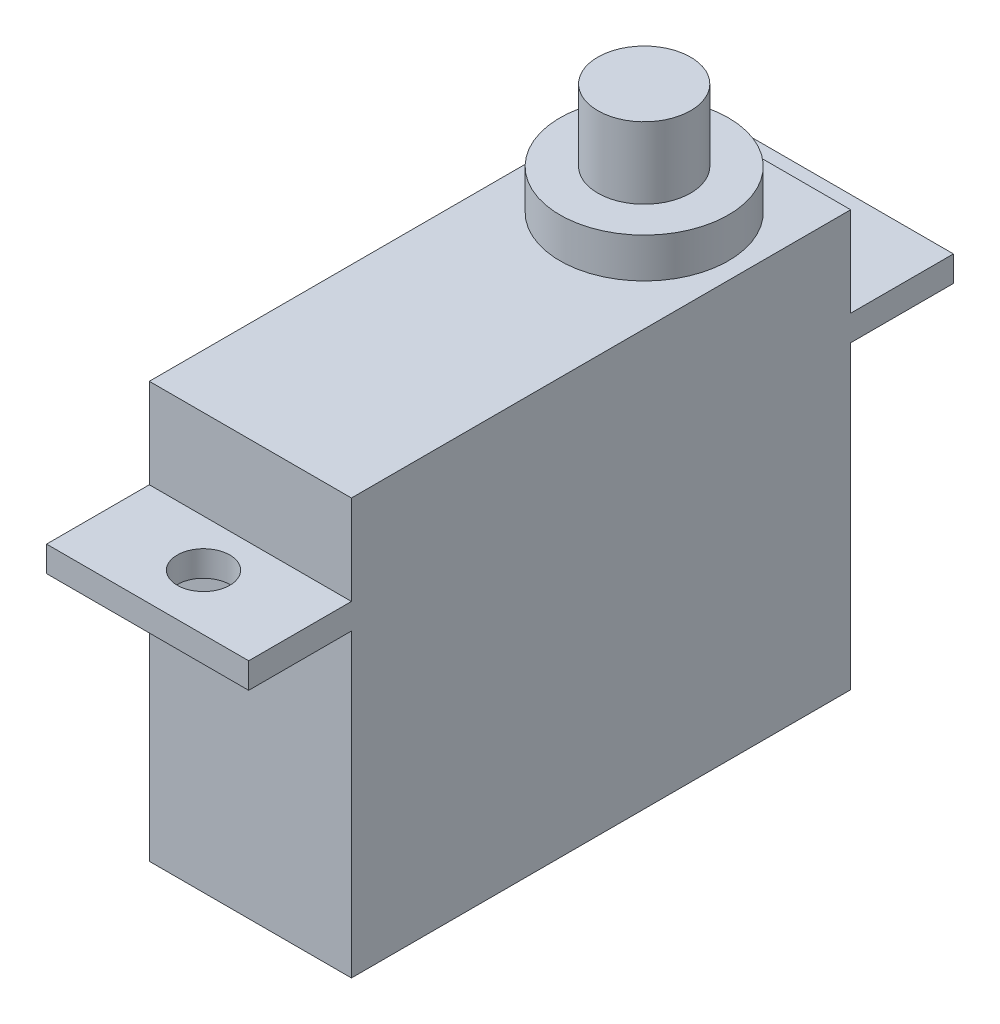
from build123d import *

# Parameters (mm, degrees)
SKETCH1_W           = 7.62
SKETCH1_H           = 18.8214
BOSS_EXTRUDE1_DEPTH = 15.6718
SKETCH2_R           = 0.9906
BOSS_EXTRUDE2_DEPTH = 0.9652
SKETCH3_R           = 3.175
BOSS_EXTRUDE3_DEPTH = 1.4986
SKETCH4_R           = 1.75
BOSS_EXTRUDE4_DEPTH = 2.6924


with BuildPart() as part:
    # Sketch1 → Boss-Extrude1 (new body)
    with BuildSketch(Plane(origin=(0, 0, 0), x_dir=(1, 0, 0), z_dir=(0, 1, 0))):
        with Locations((3.81, 9.4107)):
            Rectangle(SKETCH1_W, SKETCH1_H)
    extrude(amount=BOSS_EXTRUDE1_DEPTH)

    # Sketch2 → Boss-Extrude2 (add)
    # profile 1 of 2: a face of its own
    with BuildSketch(Plane(origin=(0, 11.3284, 0), x_dir=(-1, 0, 0), z_dir=(0, -1, 0))):
        Polygon((0, 0), (-7.62, 0), (-7.62, -3.8735), (-5.08, -3.8735), (-2.54, -3.8735), (0, -3.8735), align=None)
        with Locations(Location((-3.81, -1.7653, 0), (0, 0, 90))):
            Circle(SKETCH2_R, mode=Mode.SUBTRACT)
    # profile 2 of 2: a face of its own
    with BuildSketch(Plane(origin=(0, 11.3284, 0), x_dir=(-1, 0, 0), z_dir=(0, -1, 0))):
        Polygon((-7.62, 18.8214), (0, 18.8214), (0, 22.6949), (-2.54, 22.6949), (-5.08, 22.6949), (-7.62, 22.6949), align=None)
        with Locations(Location((-3.81, 20.5867, 0), (0, 0, 90))):
            Circle(SKETCH2_R, mode=Mode.SUBTRACT)
    extrude(amount=-BOSS_EXTRUDE2_DEPTH)

    # Sketch3 → Boss-Extrude3 (add)
    with BuildSketch(Plane(origin=(0, 15.6718, 0), x_dir=(1, 0, 0), z_dir=(0, 1, 0))):
        with Locations(Location((3.81, 14.8463, 0), (0, 0, 90))):
            Circle(SKETCH3_R)
    extrude(amount=BOSS_EXTRUDE3_DEPTH)

    # Sketch4 → Boss-Extrude4 (add)
    with BuildSketch(Plane(origin=(0, 17.1704, 0), x_dir=(1, 0, 0), z_dir=(0, 1, 0))):
        with Locations(Location((3.81, 14.8463, 0), (0, 0, 270))):
            Circle(SKETCH4_R)
    extrude(amount=BOSS_EXTRUDE4_DEPTH)


solid = part.part
